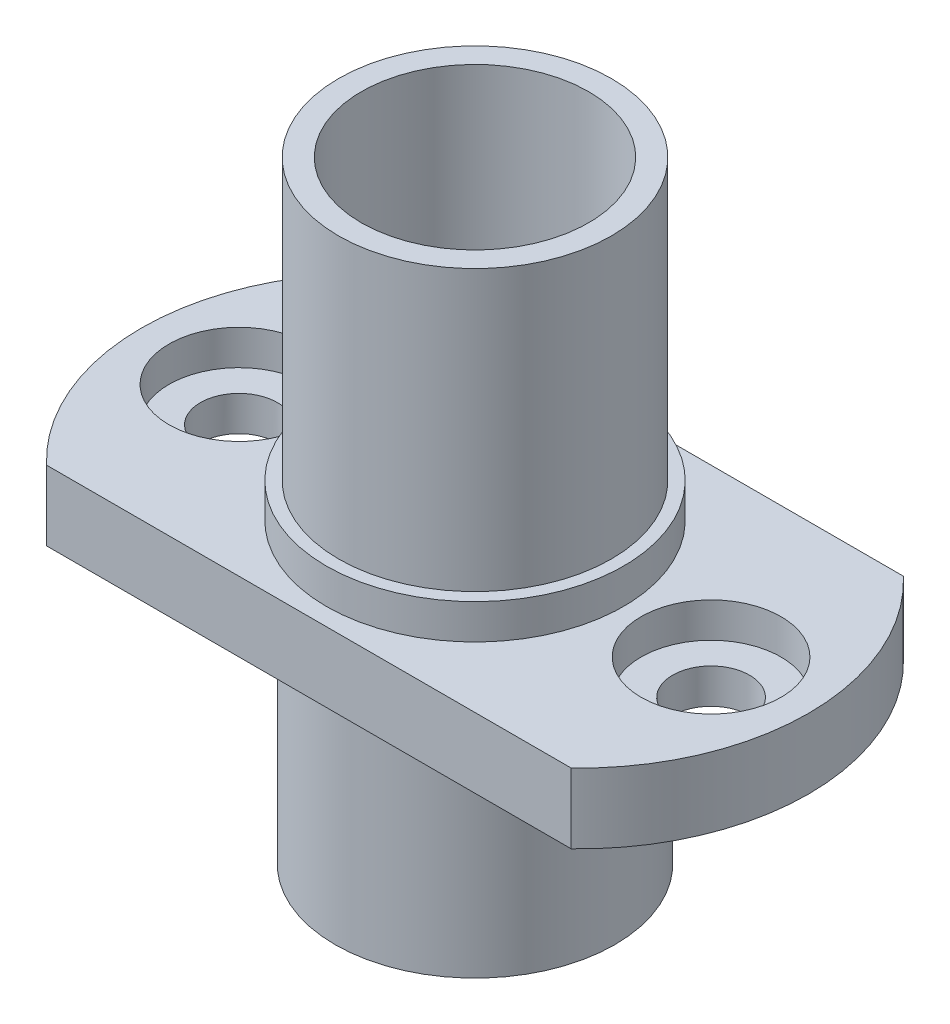
from build123d import *

# Parameters (mm, degrees)
EXTRUDE_1_DEPTH      = 1
EXTRUDE_1_DEPTH_BACK = 1
SKETCH_2_R           = 4.25
SKETCH_2_R_2         = 3.25
EXTRUDE_2_DEPTH      = 9
SKETCH_3_R           = 1.1
CUT_EXTRUDE_1_DEPTH  = 14.948989624
SKETCH_8_R           = 2
CUT_EXTRUDE_3_DEPTH  = 1
SKETCH_4_R           = 4
EXTRUDE_1_2_DEPTH    = 6.5
SKETCH_5_OUTSIDE_W   = 26.596
SKETCH_5_OUTSIDE_H   = 17.016
SKETCH_5_OUTSIDE_R   = 3.9
CUT_EXTRUDE_2_DEPTH  = 8


with BuildPart() as part:
    # 草图1 → Extrude 1 (new, two sides: drawn at the far end of the back side and taken through both)
    with BuildSketch(Plane(origin=(0, 0, 0), x_dir=(1, 0, 0), z_dir=(0, 1, 0)).offset(-EXTRUDE_1_DEPTH_BACK)):
        with BuildLine():
            Line((-7.5, 4.75), (7.5, 4.75))
            ThreePointArc((7.5, 4.75), (9.540011086, 0), (7.5, -4.75))
            Line((7.5, -4.75), (-7.5, -4.75))
            ThreePointArc((-7.5, -4.75), (-9.540011086, 0), (-7.5, 4.75))
        make_face()
    extrude(amount=EXTRUDE_1_DEPTH + EXTRUDE_1_DEPTH_BACK)

    # 草图2 → Extrude 2 (add)
    with BuildSketch(Plane(origin=(0, 1, 0), x_dir=(-1, 0, 0), z_dir=(0, 1, 0))):
        with Locations(Location((0, 0, 0), (0, 0, 270))):
            Circle(SKETCH_2_R)
        with Locations(Location((0, 0, 0), (0, 0, 90))):
            Circle(SKETCH_2_R_2, mode=Mode.SUBTRACT)
    extrude(amount=EXTRUDE_2_DEPTH)

    # 草图3 → 切除-拉伸1 (cut, through all)
    with BuildSketch(Plane(origin=(0, 1, 0), x_dir=(-1, 0, 0), z_dir=(0, 1, 0))):
        with Locations(Location((-6.75, 0, 0), (0, 0, 90))):
            Circle(SKETCH_3_R)
        with Locations(Location((6.75, 0, 0), (0, 0, 270))):
            Circle(SKETCH_3_R)
    extrude(amount=-CUT_EXTRUDE_1_DEPTH, mode=Mode.SUBTRACT)

    # 草图8 → 切除-拉伸3 (cut)
    with BuildSketch(Plane(origin=(0, 1, 0), x_dir=(1, 0, 0), z_dir=(0, 1, 0))):
        with Locations(Location((-6.75, 0, 0), (0, 0, 270))):
            Circle(SKETCH_8_R)
        with Locations(Location((6.75, 0, 0), (0, 0, 270))):
            Circle(SKETCH_8_R)
    extrude(amount=-CUT_EXTRUDE_3_DEPTH, mode=Mode.SUBTRACT)

    # 草图4 → Extrude 1 2 (add)
    with BuildSketch(Plane.XZ.offset(1)):
        with Locations(Location((0, 0, 0), (0, 0, 90))):
            Circle(SKETCH_4_R)
    extrude(amount=EXTRUDE_1_2_DEPTH)

    # 草图5 outside → 切除-拉伸2 (cut)
    with BuildSketch(Plane(origin=(0, 10, 0), x_dir=(1, 0, 0), z_dir=(0, 1, 0))):
        Rectangle(SKETCH_5_OUTSIDE_W, SKETCH_5_OUTSIDE_H)
        with Locations(Location((0, 0, 0), (0, 0, 270))):
            Circle(SKETCH_5_OUTSIDE_R, mode=Mode.SUBTRACT)
    extrude(amount=-CUT_EXTRUDE_2_DEPTH, mode=Mode.SUBTRACT)


solid = part.part
